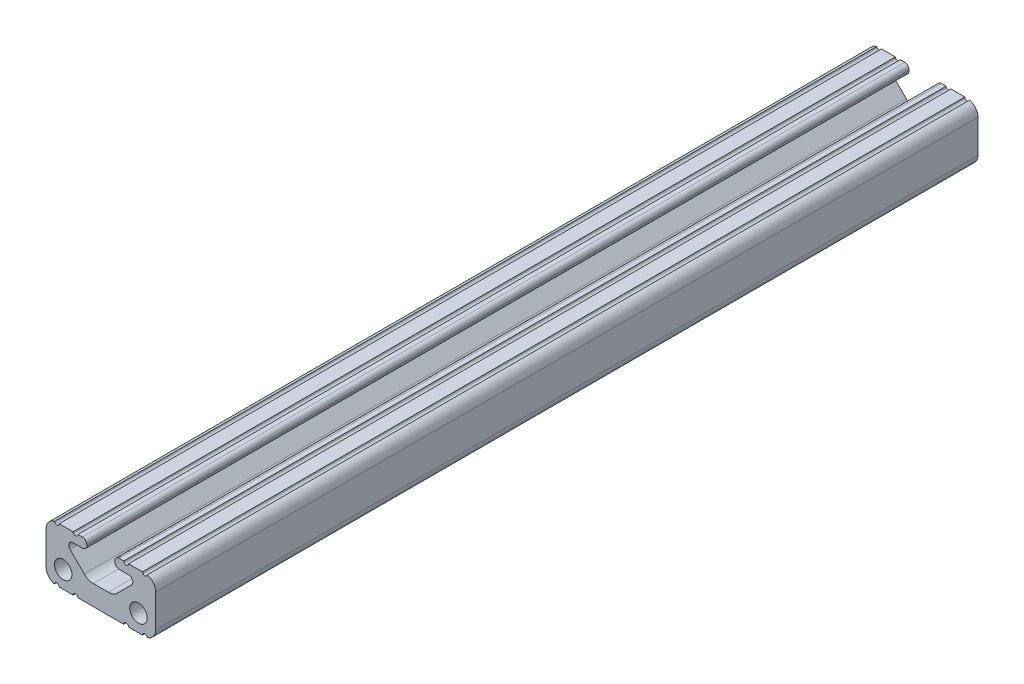
from build123d import *

# Parameters (mm, degrees)
SKETCH3_R               = 2.032
BOSS_EXTRUDE1_DEPTH     = 152.4
CUT_EXTRUDE1_DEPTH      = 154.060029074
CUT_EXTRUDE1_DEPTH_BACK = 154.060029074
SKETCH4_R               = 0.55245
SKETCH5_W               = 50.8
SKETCH5_H               = 114.3
CUT_EXTRUDE2_DEPTH      = 154.454683865


with BuildPart() as part:
    # Sketch3 → Boss-Extrude1 (new, symmetric)
    with BuildSketch(Plane.XY):
        with BuildLine():
            Line((3.2512, 5.35559), (3.2512, 5.13461))
            ThreePointArc((3.2512, 5.13461), (3.542455946, 4.431455946), (4.24561, 4.1402))
            Line((4.24561, 4.1402), (6.42239, 4.1402))
            ThreePointArc((6.42239, 4.1402), (7.341105046, 3.526334232), (7.125544054, 2.442635946))
            Line((7.125544054, 2.442635946), (3.854875946, -0.828032163))
            ThreePointArc((3.854875946, -0.828032163), (2.887046479, -1.474715138), (1.745413783, -1.7018))
            Line((1.745413783, -1.7018), (0, -1.7018))
            Line((0, -1.7018), (0, -6.35))
            Line((0, -6.35), (10.16, -6.35))
            ThreePointArc((10.16, -6.35), (11.956051224, -5.606051224), (12.7, -3.81))
            Line((12.7, -3.81), (12.7, 3.81))
            ThreePointArc((12.7, 3.81), (11.956051224, 5.606051224), (10.16, 6.35))
            Line((10.16, 6.35), (4.24561, 6.35))
            ThreePointArc((4.24561, 6.35), (3.542455946, 6.058744054), (3.2512, 5.35559))
        make_face()
        with Locations(Location((8.7249, -2.3876, 0), (0, 0, 180))):
            Circle(SKETCH3_R, mode=Mode.SUBTRACT)
    extrude(amount=BOSS_EXTRUDE1_DEPTH, both=True)

    # Sketch4 → Cut-Extrude1 (cut, two sides: drawn at the far end of the back side and taken through both)
    with BuildSketch(Plane.XY.offset(-CUT_EXTRUDE1_DEPTH_BACK)):
        with Locations((5.86994, 6.35)):
            Circle(SKETCH4_R)
        with Locations((10.20445, 6.35)):
            Circle(SKETCH4_R)
        with Locations((5.86994, -6.35)):
            Circle(SKETCH4_R)
        with Locations((10.20445, -6.35)):
            Circle(SKETCH4_R)
    extrude(amount=CUT_EXTRUDE1_DEPTH + CUT_EXTRUDE1_DEPTH_BACK, mode=Mode.SUBTRACT)

    # Mirror1: part across plane


with BuildPart() as part_1:
    add(part.part)
    add(part.part.mirror(Plane(origin=(0, 0, 0), x_dir=(0, 0, 1), z_dir=(1, 0, 0))))

    # Sketch5 → Cut-Extrude2 (cut, through all)
    with BuildSketch(Plane.XZ.offset(6.35)):
        with Locations((0, -95.25)):
            Rectangle(SKETCH5_W, SKETCH5_H)
    extrude(amount=-CUT_EXTRUDE2_DEPTH, mode=Mode.SUBTRACT)


solid = part_1.part
